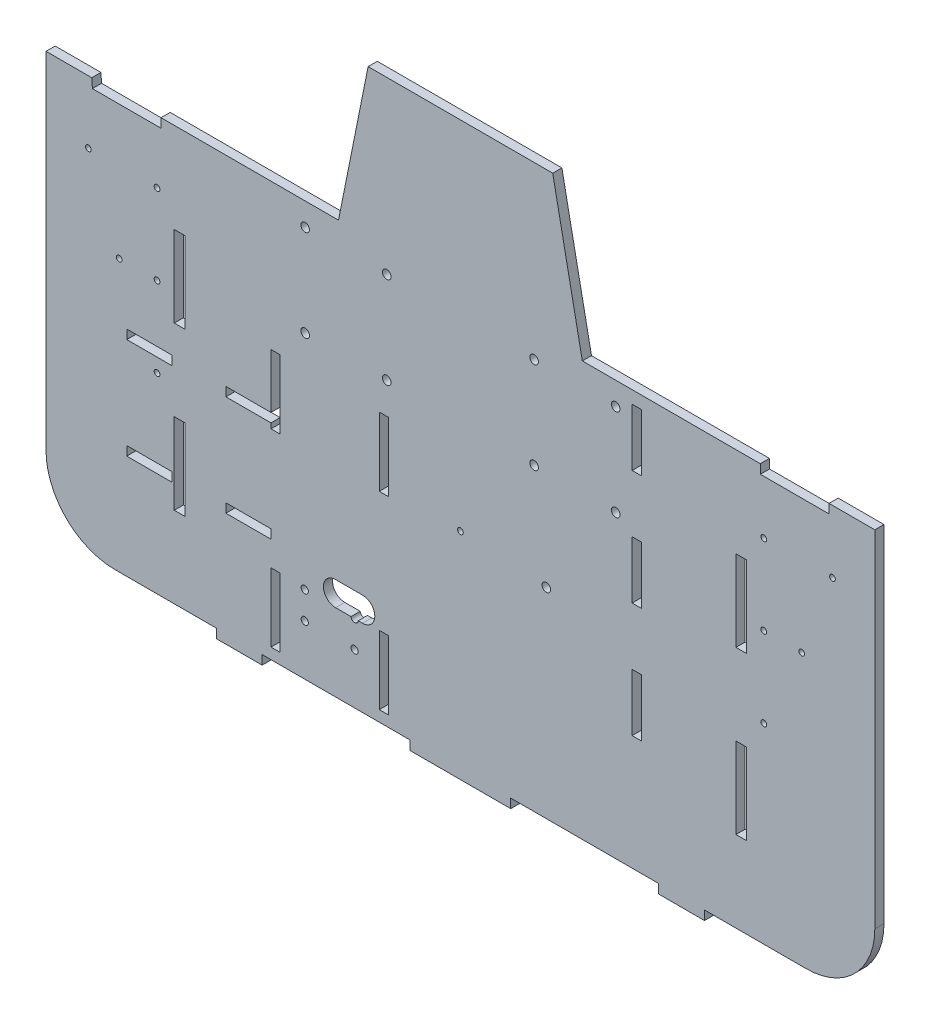
from build123d import *

# Parameters (mm, degrees)
SKETCH2_W           = 10.16
SKETCH2_H           = 76.2
SKETCH2_R           = 4
SKETCH2_W_2         = 50
SKETCH2_H_2         = 10.16
SKETCH2_W_3         = 11.850089675
SKETCH2_H_3         = 89.916
SKETCH2_H_4         = 10
SKETCH2_R_2         = 3.175
SKETCH2_H_5         = 63.685061478
SKETCH2_R_3         = 4.7625
SKETCH2_H_6         = 63.685061479
BOSS_EXTRUDE1_DEPTH = 10.16


with BuildPart() as part:
    # Sketch2 → Boss-Extrude1 (new body)
    with BuildSketch(Plane.XY):
        with BuildLine():
            Line((-408.300796745, 142.616356263), (-408.921789204, 152.75736057))
            Line((-408.921789204, 152.75736057), (-459.721789204, 152.75736057))
            Line((-459.721789204, 152.75736057), (-459.721789204, -230.782639429))
            ThreePointArc((-459.721789204, -230.782639429), (-437.403325931, -284.664176156), (-383.521789204, -306.982639429))
            Line((-383.521789204, -306.982639429), (-303.52, -306.982639429))
            Line((-303.52, -306.982639429), (-270.8, -306.98263943))
            Line((-270.8, -306.98263943), (-270.8, -317.14263943))
            Line((-270.8, -317.14263943), (-220, -317.14263943))
            Line((-220, -317.14263943), (-220, -306.98263943))
            Line((-220, -306.98263943), (-55.8292, -306.982639429))
            Line((-55.8292, -306.982639429), (-55.8292, -317.14263943))
            Line((-55.8292, -317.14263943), (55.8292, -317.14263943))
            Line((55.8292, -317.14263943), (55.8292, -306.982639429))
            Line((55.8292, -306.982639429), (220, -306.98263943))
            Line((220, -306.98263943), (220, -317.14263943))
            Line((220, -317.14263943), (270.8, -317.14263943))
            Line((270.8, -317.14263943), (270.8, -306.98263943))
            Line((270.8, -306.98263943), (303.52, -306.982639429))
            Line((303.52, -306.982639429), (383.521789204, -306.982639429))
            ThreePointArc((383.521789204, -306.982639429), (437.403325931, -284.664176156), (459.721789204, -230.782639429))
            Line((459.721789204, -230.782639429), (459.721789204, 152.75736057))
            Line((459.721789204, 152.75736057), (408.921789204, 152.75736057))
            Line((408.921789204, 152.75736057), (408.921789204, 142.616356263))
            Line((408.921789204, 142.616356263), (332.721789204, 142.616356263))
            Line((332.721789204, 142.616356263), (332.721789204, 152.75736057))
            Line((332.721789204, 152.75736057), (135.250547773, 152.75736057))
            Line((135.250547773, 152.75736057), (102.394461083, 316.728644457))
            Line((102.394461083, 316.728644457), (-102.394461083, 316.728644457))
            Line((-102.394461083, 316.728644457), (-135.250547773, 152.75736057))
            Line((-135.250547773, 152.75736057), (-332.100796745, 152.75736057))
            Line((-332.100796745, 152.75736057), (-332.100796745, 142.616356263))
            Line((-332.100796745, 142.616356263), (-408.300796745, 142.616356263))
        make_face()
        with Locations((-205.08, -256.782661115)):
            Rectangle(SKETCH2_W, SKETCH2_H, mode=Mode.SUBTRACT)
        with Locations((-172.69, -250.936605381)):
            Circle(SKETCH2_R, mode=Mode.SUBTRACT)
        with Locations((-117.38, -250.936605381)):
            Circle(SKETCH2_R, mode=Mode.SUBTRACT)
        with Locations((-84.92, -256.782661115)):
            Rectangle(SKETCH2_W, SKETCH2_H, mode=Mode.SUBTRACT)
        with Locations((-172.69, -220.936605381)):
            Circle(SKETCH2_R, mode=Mode.SUBTRACT)
        with BuildLine():
            ThreePointArc((-108.5, -194.170881029), (-95, -207.670881029), (-108.5, -221.170881029))
            Line((-108.5, -221.170881029), (-113.386866529, -221.170881029))
            ThreePointArc((-113.386866529, -221.170881029), (-117.38, -224.936605381), (-121.373133471, -221.170881029))
            Line((-121.373133471, -221.170881029), (-138.5, -221.170881029))
            ThreePointArc((-138.5, -221.170881029), (-152, -207.670881029), (-138.5, -194.170881029))
            Line((-138.5, -194.170881029), (-108.5, -194.170881029))
        make_face(mode=Mode.SUBTRACT)
        with Locations((-345.16, -186.334154613)):
            Rectangle(SKETCH2_W_2, SKETCH2_H_2, mode=Mode.SUBTRACT)
        with Locations((-311.557332494, -172.10863943)):
            Rectangle(SKETCH2_W_3, SKETCH2_H_3, mode=Mode.SUBTRACT)
        with Locations((-235.16, -186.254154613)):
            Rectangle(SKETCH2_W_2, SKETCH2_H_4, mode=Mode.SUBTRACT)
        with Locations((-336.55027219, -94.687385458)):
            Circle(SKETCH2_R_2, mode=Mode.SUBTRACT)
        with Locations((195.58, -147.752560311)):
            Rectangle(SKETCH2_W, SKETCH2_H_5, mode=Mode.SUBTRACT)
        with Locations((0, -78.38263943)):
            Circle(SKETCH2_R_2, mode=Mode.SUBTRACT)
        with Locations((95.25, -84.73263943)):
            Circle(SKETCH2_R_3, mode=Mode.SUBTRACT)
        with Locations((311.557332494, -172.10863943)):
            Rectangle(SKETCH2_W_3, SKETCH2_H_3, mode=Mode.SUBTRACT)
        with Locations((336.550272189, -94.687385458)):
            Circle(SKETCH2_R_2, mode=Mode.SUBTRACT)
        with Locations((-345.16, -74.366988355)):
            Rectangle(SKETCH2_W_2, SKETCH2_H_2, mode=Mode.SUBTRACT)
        Polygon((-210.16, -79.446988355), (-260.16, -79.446988355), (-260.16, -69.446988355), (-210.16, -69.446988355), (-210.16, -8.96237531), (-200, -8.96237531), (-200, -85.16237531), (-210.16, -85.16237531), align=None, mode=Mode.SUBTRACT)
        with Locations((-378.573819589, -5.78737531)):
            Circle(SKETCH2_R_2, mode=Mode.SUBTRACT)
        with Locations((-336.55027219, -5.787385458)):
            Circle(SKETCH2_R_2, mode=Mode.SUBTRACT)
        with Locations((-311.557332494, 7.72336057)):
            Rectangle(SKETCH2_W_3, SKETCH2_H_3, mode=Mode.SUBTRACT)
        with Locations((-84.92, -47.06237531)):
            Rectangle(SKETCH2_W, SKETCH2_H, mode=Mode.SUBTRACT)
        with Locations((-172.2755, 25.75736057)):
            Circle(SKETCH2_R_3, mode=Mode.SUBTRACT)
        with Locations((-81.7245, 25.75736057)):
            Circle(SKETCH2_R_3, mode=Mode.SUBTRACT)
        with Locations((-412.75027219, 83.112614542)):
            Circle(SKETCH2_R_2, mode=Mode.SUBTRACT)
        with Locations((-336.55027219, 83.112614542)):
            Circle(SKETCH2_R_2, mode=Mode.SUBTRACT)
        with Locations((-172.2755, 127.35736057)):
            Circle(SKETCH2_R_3, mode=Mode.SUBTRACT)
        with Locations((-81.7245, 127.35736057)):
            Circle(SKETCH2_R_3, mode=Mode.SUBTRACT)
        with Locations((81.7245, 25.75736057)):
            Circle(SKETCH2_R_3, mode=Mode.SUBTRACT)
        with Locations((195.58, -20.382437355)):
            Rectangle(SKETCH2_W, SKETCH2_H_6, mode=Mode.SUBTRACT)
        with Locations((172.2755, 25.75736057)):
            Circle(SKETCH2_R_3, mode=Mode.SUBTRACT)
        with Locations((311.557332494, 7.72336057)):
            Rectangle(SKETCH2_W_3, SKETCH2_H_3, mode=Mode.SUBTRACT)
        with Locations((336.550272189, -5.787385458)):
            Circle(SKETCH2_R_2, mode=Mode.SUBTRACT)
        with Locations((378.573819589, -5.78737531)):
            Circle(SKETCH2_R_2, mode=Mode.SUBTRACT)
        with Locations((81.7245, 127.35736057)):
            Circle(SKETCH2_R_3, mode=Mode.SUBTRACT)
        with Locations((195.58, 106.97026018)):
            Rectangle(SKETCH2_W, SKETCH2_H_6, mode=Mode.SUBTRACT)
        with Locations((172.2755, 127.35736057)):
            Circle(SKETCH2_R_3, mode=Mode.SUBTRACT)
        with Locations((336.550272189, 83.112614542)):
            Circle(SKETCH2_R_2, mode=Mode.SUBTRACT)
        with Locations((412.750272189, 83.112614542)):
            Circle(SKETCH2_R_2, mode=Mode.SUBTRACT)
    extrude(amount=-BOSS_EXTRUDE1_DEPTH)


solid = part.part
